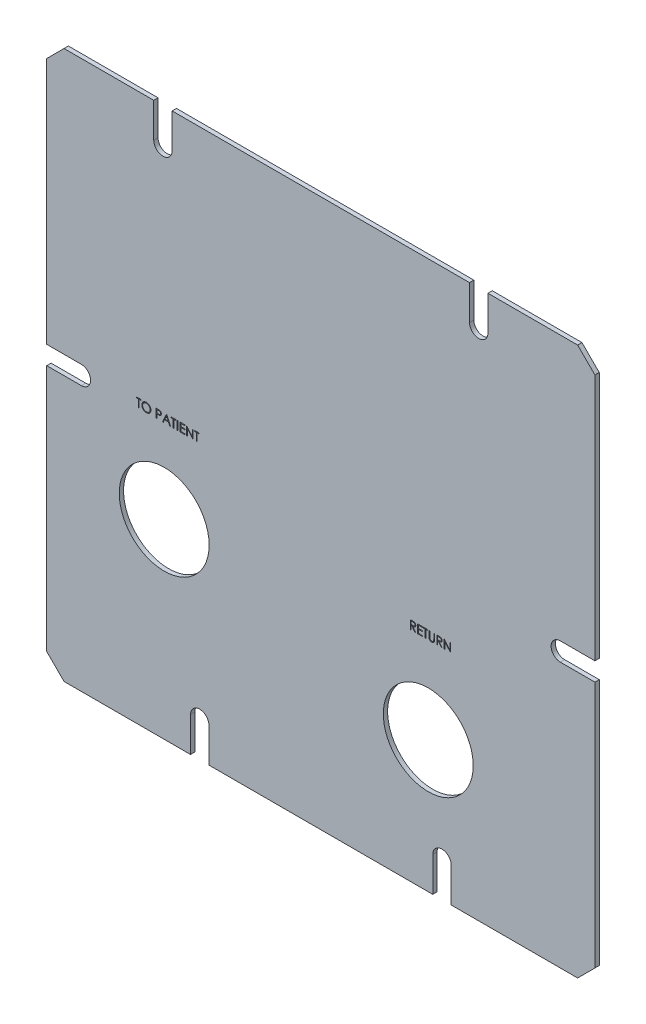
from build123d import *

# Parameters (mm, degrees)
SKETCH1_W               = 201.168
SKETCH1_H               = 201.168
BOSS_EXTRUDE1_DEPTH     = 1.5875
CUT_EXTRUDE1_REACH      = 144.256
SKETCH2_R               = 16.5
F_1_4_CLEARANCE_HOLE1_D = 6.7564
CHAMFER1_SIZE           = 6.35
SKETCH5_W               = 0.284935898
SKETCH5_H               = 3.175
CUT_EXTRUDE2_DEPTH      = 0.508
CUT_EXTRUDE3_REACH      = 144.256
SKETCH6_W               = 6.7564
SKETCH6_H               = 14.478
SKETCH6_W_2             = 14.478
SKETCH6_H_2             = 6.7564


with BuildPart() as part:
    # Sketch1 → Boss-Extrude1 (new body)
    with BuildSketch(Plane.XY):
        Rectangle(SKETCH1_W, SKETCH1_H)
    extrude(amount=BOSS_EXTRUDE1_DEPTH)

    # Sketch2 → Cut-Extrude1 (cut, up to next)
    with BuildSketch(Plane.XY.offset(1.5875), mode=Mode.PRIVATE) as cut_extrude1_sk1:
        with Locations((-57.484, -30.636)):
            Circle(SKETCH2_R)
    cut_extrude1_tool1 = extrude(cut_extrude1_sk1.sketch, amount=-CUT_EXTRUDE1_REACH, mode=Mode.PRIVATE) & part.part
    # Sketch2 → Cut-Extrude1 (cut, up to next)
    with BuildSketch(Plane.XY.offset(1.5875), mode=Mode.PRIVATE) as cut_extrude1_sk2:
        with Locations((39.4206, -52.284)):
            Circle(SKETCH2_R)
    cut_extrude1_tool2 = extrude(cut_extrude1_sk2.sketch, amount=-CUT_EXTRUDE1_REACH, mode=Mode.PRIVATE) & part.part
    add(cut_extrude1_tool1.solids().sort_by_distance((-57.484, -30.636, 1.5875))[0], mode=Mode.SUBTRACT)
    add(cut_extrude1_tool2.solids().sort_by_distance((39.4206, -52.284, 1.5875))[0], mode=Mode.SUBTRACT)

    # 1/4 Clearance Hole1 (through all)
    with Locations(Plane.XY.offset(1.5875)):
        with Locations((-57.94375, 87.884), (57.94375, 87.884), (87.884, 0), (-87.884, 0), (-44.45, -87.884), (44.45, -87.884)):
            Hole(F_1_4_CLEARANCE_HOLE1_D / 2)

    # Chamfer1
    chamfer1_edges = [part.edges().sort_by_distance(p)[0] for p in [
        (100.584, -100.584, 0.79375),
        (-100.584, -100.584, 0.79375),
        (-100.584, 100.584, 0.79375),
        (100.584, 100.584, 0.79375),
    ]]
    chamfer(chamfer1_edges, length=CHAMFER1_SIZE)

    # Sketch5 → Cut-Extrude2 (cut)
    # profile 1 of 15: a face of its own
    with BuildSketch(Plane.XY.offset(1.5875)):
        Polygon((-67.686953674, 2.849358974), (-67.686953674, 3.175), (-66.018043418, 3.175), (-66.018043418, 2.849358974), (-66.710030597, 2.849358974), (-66.710030597, 0), (-66.994966495, 0), (-66.994966495, 2.849358974), align=None)
    # profile 2 of 15: a face of its own
    with BuildSketch(Plane.XY.offset(1.5875)):
        with BuildLine():
            add(Edge.make_bspline(
                [(-64.0438447, 3.256410256), (-63.985054489, 3.2549212), (-63.869585666, 3.251996571), (-63.699882009, 3.229609098), (-63.537870744, 3.19087828), (-63.382232118, 3.139295432), (-63.234827775, 3.070484668), (-63.094548208, 2.98731314), (-62.961727187, 2.888909496), (-62.838154933, 2.776034411), (-62.725073271, 2.653222278), (-62.625445503, 2.522160174), (-62.541949994, 2.383640546), (-62.473382887, 2.23807965), (-62.419590577, 2.085806679), (-62.382471158, 1.926009834), (-62.358760122, 1.759724479), (-62.355988095, 1.646307252), (-62.354581879, 1.588772035)],
                knots=[0, 0, 0, 0, 1.065120563, 2.091984664, 3.0946048, 4.079830382, 5.057816894, 6.036188127, 7.030412546, 8.04752943, 9.064399622, 10.05169764, 11.02544977, 11.989514704, 12.962713494, 13.945757189, 14.957906945, 16, 16, 16, 16], degree=3))
            add(Edge.make_bspline(
                [(-62.354581879, 1.588772035), (-62.355987889, 1.531660637), (-62.358759298, 1.419087456), (-62.382498118, 1.253857332), (-62.419728168, 1.095025057), (-62.472883352, 0.942855786), (-62.541123608, 0.797188996), (-62.625175084, 0.658407974), (-62.724181754, 0.526467222), (-62.836855112, 0.402812161), (-62.9596832, 0.289421599), (-63.091427799, 0.190616618), (-63.229126025, 0.105595448), (-63.374549832, 0.037755973), (-63.52577058, -0.016465698), (-63.684141687, -0.053434155), (-63.848921061, -0.077280259), (-63.961289757, -0.080018484), (-64.018403995, -0.081410256)],
                knots=[0, 0, 0, 0, 1.043624062, 2.057103931, 3.04512605, 4.022047818, 4.998200453, 5.980619268, 6.982898556, 8.009068085, 9.034988726, 10.034168286, 11.015286542, 11.987931943, 12.962482838, 13.94673481, 14.956375938, 16, 16, 16, 16], degree=3))
            add(Edge.make_bspline(
                [(-64.018403995, -0.081410256), (-64.075938913, -0.080004741), (-64.189355551, -0.077234097), (-64.355849862, -0.053483822), (-64.515758958, -0.016344211), (-64.668625548, 0.036732206), (-64.814534877, 0.105327837), (-64.953772309, 0.188970381), (-65.085778964, 0.288218287), (-65.209460406, 0.400855109), (-65.32262575, 0.523475017), (-65.421286041, 0.654860377), (-65.504947393, 0.792433541), (-65.573312702, 0.936576295), (-65.62743689, 1.086591818), (-65.664361975, 1.243480794), (-65.688252446, 1.406348774), (-65.691005485, 1.517240546), (-65.692402392, 1.573507612)],
                knots=[0, 0, 0, 0, 1.053102029, 2.075944431, 3.073151272, 4.055350789, 5.033113405, 6.020478099, 7.024410459, 8.052272461, 9.079885166, 10.07527673, 11.055994387, 12.023226415, 12.992069828, 13.970394897, 14.97016774, 16, 16, 16, 16], degree=3))
            add(Edge.make_bspline(
                [(-65.692402392, 1.573507612), (-65.691917401, 1.611274391), (-65.690953538, 1.686331503), (-65.679349646, 1.797789061), (-65.662511531, 1.907454158), (-65.638379796, 2.015014947), (-65.606818784, 2.120208126), (-65.56957873, 2.223759175), (-65.524094728, 2.324618696), (-65.472677283, 2.423264487), (-65.415289786, 2.518158801), (-65.351902499, 2.607856709), (-65.284741843, 2.693110899), (-65.21111505, 2.771712109), (-65.133448703, 2.845946926), (-65.050482889, 2.914674534), (-64.962723853, 2.978514668), (-64.86979398, 3.036045977), (-64.773983116, 3.088078906), (-64.675216325, 3.132730157), (-64.574835006, 3.17105337), (-64.472369004, 3.20211469), (-64.368090418, 3.226636608), (-64.261771657, 3.243334708), (-64.15349742, 3.254968196), (-64.080552866, 3.255927501), (-64.0438447, 3.256410256)],
                knots=[0, 0, 0, 0, 1.037015668, 2.060948919, 3.074880161, 4.083647147, 5.086022904, 6.090072063, 7.104153813, 8.122640571, 9.144368836, 10.147691507, 11.138137339, 12.123020368, 13.103399296, 14.087645067, 15.080126199, 16.082011238, 17.087798457, 18.072939717, 19.057185487, 20.037253025, 21.01195951, 21.997135196, 22.992090687, 24, 24, 24, 24], degree=3))
        make_face()
        with BuildLine():
            add(Edge.make_bspline(
                [(-64.029852312, 2.930769231), (-64.059982729, 2.930401937), (-64.119955516, 2.929670862), (-64.209113631, 2.920040892), (-64.297099171, 2.906315921), (-64.383930306, 2.886738399), (-64.469243726, 2.860064722), (-64.553834653, 2.829366184), (-64.636931709, 2.791972766), (-64.718260566, 2.74972467), (-64.797104956, 2.702962435), (-64.871502192, 2.651280903), (-64.941644876, 2.595892072), (-65.007361268, 2.536666676), (-65.068458403, 2.473303109), (-65.126138811, 2.406761971), (-65.178090503, 2.335141327), (-65.225702419, 2.260383315), (-65.26830896, 2.182585309), (-65.306196103, 2.102566362), (-65.337187739, 2.019673747), (-65.362462895, 1.934806761), (-65.383417723, 1.848099815), (-65.396692783, 1.758895152), (-65.406428566, 1.667641015), (-65.407117855, 1.605971762), (-65.407466495, 1.574779647)],
                knots=[0, 0, 0, 0, 1.008559885, 2.007477868, 2.99961109, 3.989939068, 4.984837346, 5.991145699, 7.001802488, 8.033829008, 9.059044045, 10.069351652, 11.065060232, 12.050310815, 13.029377138, 14.011219647, 14.996725999, 15.989392538, 16.977580475, 17.965360261, 18.951710183, 19.937753436, 20.929683414, 21.935841486, 22.955955122, 24, 24, 24, 24], degree=3))
            add(Edge.make_bspline(
                [(-65.407466495, 1.574779647), (-65.406310013, 1.52891249), (-65.404034855, 1.438677602), (-65.384116202, 1.306445071), (-65.35343484, 1.179364983), (-65.308207086, 1.05813268), (-65.251646171, 0.94170608), (-65.181771778, 0.831118014), (-65.09898675, 0.726338592), (-65.004949122, 0.628099312), (-64.902149238, 0.538432047), (-64.792990262, 0.459725241), (-64.678641632, 0.393131657), (-64.558805156, 0.338879913), (-64.434120602, 0.29589065), (-64.303784538, 0.266427892), (-64.168665193, 0.247037301), (-64.076562384, 0.245175158), (-64.029852312, 0.244230769)],
                knots=[0, 0, 0, 0, 1.032063989, 2.030389145, 3.003944642, 3.970395727, 4.937377036, 5.913328081, 6.909231446, 7.93887556, 8.970685674, 9.976071282, 10.964166581, 11.944589148, 12.933237628, 13.927779006, 14.949070134, 16, 16, 16, 16], degree=3))
            add(Edge.make_bspline(
                [(-64.029852312, 0.244230769), (-63.99845655, 0.24466212), (-63.936189324, 0.245517617), (-63.8435741, 0.254134274), (-63.752627394, 0.267951755), (-63.663476768, 0.287845993), (-63.576223404, 0.31274453), (-63.490503118, 0.342324398), (-63.407228955, 0.379228061), (-63.325350388, 0.420002274), (-63.246976654, 0.466484417), (-63.172159564, 0.516411882), (-63.102784925, 0.57171913), (-63.037117696, 0.630064575), (-62.975769721, 0.692624637), (-62.919155857, 0.759317981), (-62.867466737, 0.830565577), (-62.8198729, 0.905210195), (-62.777415655, 0.983221081), (-62.740423186, 1.063530146), (-62.709039567, 1.145939638), (-62.683704423, 1.230568421), (-62.663851183, 1.317255762), (-62.650171541, 1.406117733), (-62.640602601, 1.496976565), (-62.639881352, 1.558429921), (-62.639517777, 1.589408053)],
                knots=[0, 0, 0, 0, 1.047197238, 2.076906641, 3.100256066, 4.114471768, 5.12198147, 6.126382909, 7.136867548, 8.15857795, 9.17633901, 10.174870724, 11.156907918, 12.133735059, 13.104061851, 14.077631395, 15.04955518, 16.038496417, 17.029181396, 18.010275684, 18.986308667, 19.968651475, 20.955262928, 21.950658345, 22.966943676, 24, 24, 24, 24], degree=3))
            add(Edge.make_bspline(
                [(-62.639517777, 1.589408053), (-62.639881643, 1.62017426), (-62.64060344, 1.6812047), (-62.650166971, 1.771429871), (-62.663865636, 1.859652427), (-62.683607521, 1.94552602), (-62.709053017, 2.029072539), (-62.740428667, 2.110213517), (-62.77742676, 2.189251237), (-62.819888507, 2.265990349), (-62.867618575, 2.339627433), (-62.919774067, 2.410023907), (-62.97725549, 2.475857751), (-63.038420527, 2.538754224), (-63.104796973, 2.597371881), (-63.176084154, 2.651730167), (-63.251416633, 2.703140923), (-63.331179197, 2.749519112), (-63.413496926, 2.792349166), (-63.497964588, 2.829044004), (-63.583625271, 2.860224427), (-63.670261145, 2.886819102), (-63.758601418, 2.906239244), (-63.848049177, 2.92005326), (-63.938480668, 2.92966751), (-63.999298446, 2.930400825), (-64.029852312, 2.930769231)],
                knots=[0, 0, 0, 0, 1.02996197, 2.043119294, 3.035359645, 4.018872909, 4.991431989, 5.957985074, 6.929999688, 7.912076566, 8.892894881, 9.867085534, 10.843653904, 11.817741046, 12.803660682, 13.806313499, 14.818574707, 15.856120519, 16.894564902, 17.924820532, 18.937903209, 19.946497019, 20.957711757, 21.963978472, 22.977135795, 24, 24, 24, 24], degree=3))
        make_face(mode=Mode.SUBTRACT)
    # profile 3 of 15: a face of its own
    with BuildSketch(Plane.XY.offset(1.5875)):
        with BuildLine():
            Line((-60.482145982, 3.175), (-59.859484724, 3.175))
            add(Edge.make_bspline(
                [(-59.859484724, 3.175), (-59.816657687, 3.174952923), (-59.734599184, 3.17486272), (-59.616929098, 3.172127915), (-59.510058841, 3.16847513), (-59.414218853, 3.163411556), (-59.32911425, 3.157427506), (-59.255130128, 3.149034585), (-59.191684959, 3.140271317), (-59.153669823, 3.131361898), (-59.13633268, 3.127298678)],
                knots=[0, 0, 0, 0, 1.415646017, 2.712440637, 3.8905458, 4.950247383, 5.884950622, 6.709939814, 7.411656543, 8, 8, 8, 8], degree=3))
            add(Edge.make_bspline(
                [(-59.13633268, 3.127298678), (-59.114385689, 3.121291623), (-59.07100886, 3.109419063), (-59.008505771, 3.085639471), (-58.949039068, 3.057443507), (-58.892404726, 3.025308933), (-58.839298693, 2.987857028), (-58.788928642, 2.946605961), (-58.741739088, 2.900603324), (-58.697995397, 2.850365081), (-58.657822759, 2.796734605), (-58.62323369, 2.738911296), (-58.594271134, 2.677868471), (-58.569430595, 2.613648589), (-58.551552211, 2.545712367), (-58.538083952, 2.474531849), (-58.529535376, 2.400114666), (-58.528716623, 2.349260357), (-58.528299828, 2.323372396)],
                knots=[0, 0, 0, 0, 0.999701418, 1.975846123, 2.934577507, 3.890451536, 4.834027766, 5.787354733, 6.749476667, 7.726910423, 8.712836071, 9.690891519, 10.682875813, 11.679750201, 12.712814741, 13.765529915, 14.8625177, 16, 16, 16, 16], degree=3))
            add(Edge.make_bspline(
                [(-58.528299828, 2.323372396), (-58.52868212, 2.297266841), (-58.529430101, 2.24618956), (-58.538407446, 2.171465674), (-58.550499834, 2.100056849), (-58.569093589, 2.032121418), (-58.593446449, 1.968062827), (-58.62201424, 1.906902138), (-58.656470728, 1.849679864), (-58.696062824, 1.796188264), (-58.740106056, 1.74637713), (-58.788414078, 1.700607423), (-58.840791865, 1.659147059), (-58.897072957, 1.62190309), (-58.957806034, 1.589739179), (-59.022069987, 1.560930767), (-59.090423398, 1.536736305), (-59.137724107, 1.524009035), (-59.161773386, 1.517538061)],
                knots=[0, 0, 0, 0, 1.121902311, 2.195077645, 3.232258892, 4.234102512, 5.217864754, 6.176164875, 7.132989551, 8.084763148, 9.034132444, 9.988522005, 10.94243251, 11.903244335, 12.886203696, 13.894208494, 14.929344452, 16, 16, 16, 16], degree=3))
            add(Edge.make_bspline(
                [(-59.161773386, 1.517538061), (-59.18166461, 1.513308071), (-59.225257385, 1.504037802), (-59.29705114, 1.493688702), (-59.380640169, 1.484855307), (-59.47591038, 1.478232132), (-59.582776258, 1.472562155), (-59.701295613, 1.468055384), (-59.831701097, 1.465579017), (-59.92266144, 1.465451298), (-59.970151791, 1.465384615)],
                knots=[0, 0, 0, 0, 0.601384939, 1.31797006, 2.144135048, 3.087295005, 4.142315834, 5.309527816, 6.595305764, 8, 8, 8, 8], degree=3))
            Line((-59.970151791, 1.465384615), (-60.197210084, 1.465384615))
            Line((-60.197210084, 1.465384615), (-60.197210084, 0))
            Line((-60.197210084, 0), (-60.482145982, 0))
            Line((-60.482145982, 0), (-60.482145982, 3.175))
        make_face()
        with BuildLine():
            Line((-60.197210084, 2.849358974), (-60.197210084, 1.791025641))
            Line((-60.197210084, 1.791025641), (-59.641330677, 1.784029447))
            add(Edge.make_bspline(
                [(-59.641330677, 1.784029447), (-59.61418903, 1.784015419), (-59.56179264, 1.783988339), (-59.486104066, 1.787603506), (-59.415882784, 1.791776847), (-59.351344491, 1.797887291), (-59.292460093, 1.806524432), (-59.239131406, 1.815243652), (-59.191771943, 1.827857802), (-59.136346238, 1.8448423), (-59.074584916, 1.873809745), (-59.007395068, 1.915855716), (-58.950453179, 1.969450359), (-58.901178724, 2.029709891), (-58.862075535, 2.096746959), (-58.833449742, 2.16847378), (-58.816630263, 2.244154758), (-58.814374931, 2.295941855), (-58.813235725, 2.322100361)],
                knots=[0, 0, 0, 0, 1.160613943, 2.240541288, 3.23993089, 4.169200891, 5.011653406, 5.7853311, 6.478053781, 7.106038997, 8.262395093, 9.384106736, 10.481365981, 11.59014053, 12.70357646, 13.786202915, 14.881775077, 16, 16, 16, 16], degree=3))
            add(Edge.make_bspline(
                [(-58.813235725, 2.322100361), (-58.814381126, 2.347626012), (-58.816658041, 2.398367848), (-58.833581574, 2.472734295), (-58.86201988, 2.543705256), (-58.901441219, 2.609902269), (-58.949284959, 2.669944969), (-59.00489222, 2.722103078), (-59.068132107, 2.764032765), (-59.126958717, 2.791095813), (-59.179211221, 2.80761967), (-59.224597356, 2.819181061), (-59.275842468, 2.82841179), (-59.332963239, 2.835886196), (-59.395516939, 2.842284693), (-59.464040982, 2.846626258), (-59.538275787, 2.849167579), (-59.58981109, 2.849293631), (-59.61652599, 2.849358974)],
                knots=[0, 0, 0, 0, 1.120700087, 2.227813068, 3.331159281, 4.466773991, 5.599788987, 6.693661531, 7.80175334, 8.91857717, 9.525282508, 10.207424825, 10.974604443, 11.810962634, 12.737642355, 13.736264703, 14.826523623, 16, 16, 16, 16], degree=3))
            Line((-59.61652599, 2.849358974), (-60.197210084, 2.849358974))
        make_face(mode=Mode.SUBTRACT)
    # profile 4 of 15: a face of its own
    with BuildSketch(Plane.XY.offset(1.5875)):
        Polygon((-56.574453674, 3.175), (-55.109069059, 0), (-55.418809644, 0), (-55.888190653, 1.017628205), (-57.327498546, 1.017628205), (-57.810235926, 0), (-58.121248546, 0), (-56.615158802, 3.175), align=None)
        Polygon((-56.597986326, 2.556154848), (-57.172946262, 1.343269231), (-56.038290813, 1.343269231), align=None, mode=Mode.SUBTRACT)
    # profile 5 of 15: a face of its own
    with BuildSketch(Plane.XY.offset(1.5875)):
        Polygon((-54.905543418, 2.849358974), (-54.905543418, 3.175), (-53.236633161, 3.175), (-53.236633161, 2.849358974), (-53.928620341, 2.849358974), (-53.928620341, 0), (-54.213556238, 0), (-54.213556238, 2.849358974), align=None)
    # profile 6 of 15: a face of its own
    with BuildSketch(Plane.XY.offset(1.5875)):
        with Locations((-52.605703674, 1.5875)):
            Rectangle(SKETCH5_W, SKETCH5_H)
    # profile 7 of 15: a face of its own
    with BuildSketch(Plane.XY.offset(1.5875)):
        Polygon((-51.649133161, 3.175), (-49.85810752, 3.175), (-49.85810752, 2.849358974), (-51.364197264, 2.849358974), (-51.364197264, 1.872435897), (-49.85810752, 1.872435897), (-49.85810752, 1.546794872), (-51.364197264, 1.546794872), (-51.364197264, 0.325641026), (-49.85810752, 0.325641026), (-49.85810752, 0), (-51.649133161, 0), align=None)
    # profile 8 of 15: a face of its own
    with BuildSketch(Plane.XY.offset(1.5875)):
        Polygon((-49.288235725, 0), (-49.288235725, 3.175), (-49.228450068, 3.175), (-47.13086393, 0.676086739), (-47.13086393, 3.175), (-46.845928033, 3.175), (-46.845928033, 0), (-46.910801831, 0), (-49.003299828, 2.493189103), (-49.003299828, 0), align=None)
    # profile 9 of 15: a face of its own
    with BuildSketch(Plane.XY.offset(1.5875)):
        Polygon((-46.398171623, 2.849358974), (-46.398171623, 3.175), (-44.729261366, 3.175), (-44.729261366, 2.849358974), (-45.421248546, 2.849358974), (-45.421248546, 0), (-45.706184443, 0), (-45.706184443, 2.849358974), align=None)
    # profile 10 of 15: a face of its own
    with BuildSketch(Plane.XY.offset(1.5875)):
        Polygon((45.225025641, -20.534), (45.225025641, -17.359), (45.284811298, -17.359), (47.382397436, -19.857913261), (47.382397436, -17.359), (47.667333333, -17.359), (47.667333333, -20.534), (47.602459535, -20.534), (45.509961538, -18.040810897), (45.509961538, -20.534), align=None)
    # profile 11 of 15: a face of its own
    with BuildSketch(Plane.XY.offset(1.5875)):
        with BuildLine():
            Line((42.538487179, -17.359), (43.17386879, -17.359))
            add(Edge.make_bspline(
                [(43.17386879, -17.359), (43.216269671, -17.359141139), (43.297684059, -17.359412141), (43.414318383, -17.360923226), (43.520297249, -17.365254248), (43.615565247, -17.36898132), (43.700120626, -17.375777582), (43.774222669, -17.382273311), (43.83753008, -17.390776561), (43.875853102, -17.398673623), (43.893204728, -17.402249199)],
                knots=[0, 0, 0, 0, 1.410062039, 2.707475311, 3.878576406, 4.937260626, 5.877586885, 6.699081471, 7.410979367, 8, 8, 8, 8], degree=3))
            add(Edge.make_bspline(
                [(43.893204728, -17.402249199), (43.916433594, -17.407988479), (43.962395791, -17.419344604), (44.028571923, -17.443347242), (44.091631345, -17.471123616), (44.151312114, -17.503747848), (44.207315296, -17.541462112), (44.260218335, -17.583615338), (44.310261291, -17.629976874), (44.355420342, -17.681715623), (44.398000767, -17.735995886), (44.433913307, -17.794691437), (44.464870899, -17.856070108), (44.48951844, -17.920756123), (44.509364887, -17.988122159), (44.52335869, -18.058778424), (44.531750839, -18.132403023), (44.532605236, -18.182620555), (44.533038462, -18.208083534)],
                knots=[0, 0, 0, 0, 1.027469482, 2.033020251, 3.019912614, 3.986113645, 4.951240523, 5.91722682, 6.890402269, 7.87763091, 8.8651537, 9.85103654, 10.82876324, 11.815024772, 12.821070561, 13.842952187, 14.906261191, 16, 16, 16, 16], degree=3))
            add(Edge.make_bspline(
                [(44.533038462, -18.208083534), (44.53170587, -18.250388236), (44.52910564, -18.332935667), (44.504862153, -18.452733752), (44.465150596, -18.564484059), (44.410428755, -18.66804588), (44.340742516, -18.761400537), (44.256990742, -18.843397593), (44.159126708, -18.912013799), (44.068022972, -18.959595987), (43.987546519, -18.990069554), (43.921294871, -19.011511108), (43.849025542, -19.028077319), (43.771430959, -19.042918296), (43.688188215, -19.054123047), (43.599496822, -19.062329601), (43.505293527, -19.067458631), (43.4405788, -19.068222449), (43.40728726, -19.068615385)],
                knots=[0, 0, 0, 0, 1.260483769, 2.459530307, 3.627416485, 4.787058657, 5.939039949, 7.08810263, 8.267026773, 9.491475466, 10.141966685, 10.831826277, 11.566392101, 12.351337768, 13.187381173, 14.07005841, 15.007169909, 16, 16, 16, 16], degree=3))
            Line((43.40728726, -19.068615385), (44.57374359, -20.534))
            Line((44.57374359, -20.534), (44.221389824, -20.534))
            Line((44.221389824, -20.534), (43.054933494, -19.068615385))
            Line((43.054933494, -19.068615385), (42.823423077, -19.068615385))
            Line((42.823423077, -19.068615385), (42.823423077, -20.534))
            Line((42.823423077, -20.534), (42.538487179, -20.534))
            Line((42.538487179, -20.534), (42.538487179, -17.359))
        make_face()
        with BuildLine():
            Line((42.823423077, -17.684641026), (42.823423077, -18.742974359))
            Line((42.823423077, -18.742974359), (43.404743189, -18.747426482))
            add(Edge.make_bspline(
                [(43.404743189, -18.747426482), (43.431884939, -18.74743849), (43.48449338, -18.747461764), (43.560603269, -18.743838838), (43.63146937, -18.7397174), (43.696820624, -18.73341335), (43.756686224, -18.725288914), (43.811036249, -18.715126207), (43.859959417, -18.703286121), (43.917017377, -18.684960361), (43.980731945, -18.65592633), (44.049975484, -18.613684771), (44.10894189, -18.560554212), (44.158760237, -18.49979972), (44.198791935, -18.433001123), (44.227015013, -18.360959131), (44.244924229, -18.285492467), (44.247036552, -18.233623755), (44.248102564, -18.207447516)],
                knots=[0, 0, 0, 0, 1.146690395, 2.22261258, 3.21895312, 4.145990853, 4.996080663, 5.770904154, 6.481378293, 7.121626537, 8.300444488, 9.431385265, 10.535395872, 11.636531494, 12.74115979, 13.810798291, 14.895190096, 16, 16, 16, 16], degree=3))
            add(Edge.make_bspline(
                [(44.248102564, -18.207447516), (44.247012069, -18.181914553), (44.244851104, -18.131317536), (44.227208293, -18.05724396), (44.197372925, -17.987333227), (44.157166324, -17.92186973), (44.108181376, -17.86244667), (44.050743075, -17.811603895), (43.986421933, -17.769649024), (43.926304489, -17.742838978), (43.872570596, -17.726401683), (43.825916548, -17.714834556), (43.773201136, -17.705541359), (43.714168398, -17.698095475), (43.649070347, -17.691695633), (43.577577828, -17.687385091), (43.500165178, -17.684832514), (43.446510461, -17.684706341), (43.418735577, -17.684641026)],
                knots=[0, 0, 0, 0, 1.101028733, 2.181837193, 3.264309656, 4.369019818, 5.486613113, 6.575447106, 7.666700264, 8.788928104, 9.402425223, 10.0903467, 10.862060571, 11.710948788, 12.657782767, 13.684531032, 14.801375019, 16, 16, 16, 16], degree=3))
            Line((43.418735577, -17.684641026), (42.823423077, -17.684641026))
        make_face(mode=Mode.SUBTRACT)
    # profile 12 of 15: a face of its own
    with BuildSketch(Plane.XY.offset(1.5875)):
        with BuildLine():
            Line((39.689128205, -17.359), (39.974064103, -17.359))
            Line((39.974064103, -17.359), (39.974064103, -19.261328726))
            add(Edge.make_bspline(
                [(39.974064103, -19.261328726), (39.974021699, -19.288253393), (39.973941231, -19.33934759), (39.974478726, -19.412071691), (39.97598401, -19.476725993), (39.976933026, -19.533559716), (39.97904425, -19.582312065), (39.98076605, -19.623247168), (39.982979984, -19.656171195), (39.98564074, -19.675385321), (39.986784455, -19.683644431)],
                knots=[0, 0, 0, 0, 1.528628734, 2.90083645, 4.128790002, 5.200304208, 6.127813768, 6.898992206, 7.526736466, 8, 8, 8, 8], degree=3))
            add(Edge.make_bspline(
                [(39.986784455, -19.683644431), (39.99148115, -19.713441138), (40.000609898, -19.771355614), (40.023874826, -19.853822412), (40.056366416, -19.928145949), (40.094868319, -19.996645478), (40.145607188, -20.057414397), (40.206388966, -20.113395682), (40.280028799, -20.162355819), (40.361908063, -20.207124056), (40.450159671, -20.243105952), (40.540339892, -20.270314218), (40.631093166, -20.286895791), (40.691850115, -20.288815795), (40.722020833, -20.289769231)],
                knots=[0, 0, 0, 0, 1.035780045, 2.013197591, 2.933192213, 3.817615948, 4.702609284, 5.640816605, 6.646850145, 7.73207398, 8.84249596, 9.914020372, 10.964143139, 12, 12, 12, 12], degree=3))
            add(Edge.make_bspline(
                [(40.722020833, -20.289769231), (40.747923155, -20.288795095), (40.799578193, -20.28685245), (40.876328313, -20.274822438), (40.951076983, -20.25314121), (41.024193314, -20.225165144), (41.092728849, -20.188201258), (41.156721829, -20.145501282), (41.213839112, -20.09541713), (41.265961725, -20.039990389), (41.311350559, -19.977452142), (41.35069438, -19.909164117), (41.382921474, -19.834098638), (41.398835957, -19.781344269), (41.407011819, -19.754242388)],
                knots=[0, 0, 0, 0, 0.994687771, 1.983630487, 2.973142513, 3.978332533, 4.983357753, 5.956394766, 6.925816176, 7.893390482, 8.871859704, 9.88551698, 10.913711441, 12, 12, 12, 12], degree=3))
            add(Edge.make_bspline(
                [(41.407011819, -19.754242388), (41.409733361, -19.743040467), (41.415798054, -19.718078072), (41.421465016, -19.675876616), (41.427367364, -19.626084122), (41.431462724, -19.568342834), (41.43545526, -19.502846238), (41.437843833, -19.429253133), (41.438947856, -19.347830747), (41.439276859, -19.291009893), (41.439448718, -19.261328726)],
                knots=[0, 0, 0, 0, 0.558680831, 1.244966039, 2.062412453, 2.990489873, 4.051219941, 5.244515665, 6.560634259, 8, 8, 8, 8], degree=3))
            Line((41.439448718, -19.261328726), (41.439448718, -17.359))
            Line((41.439448718, -17.359), (41.724384615, -17.359))
            Line((41.724384615, -17.359), (41.724384615, -19.276593149))
            add(Edge.make_bspline(
                [(41.724384615, -19.276593149), (41.724154092, -19.311153821), (41.723704211, -19.378601075), (41.719802974, -19.477435522), (41.713582696, -19.571191441), (41.704794216, -19.659881434), (41.69314922, -19.743188135), (41.680199556, -19.821841747), (41.663708122, -19.895277676), (41.644446394, -19.964068512), (41.622426818, -20.029551085), (41.593905205, -20.091698185), (41.561770123, -20.152399105), (41.523656831, -20.210735746), (41.480829362, -20.266966405), (41.432341052, -20.320750066), (41.379795563, -20.372946201), (41.322319391, -20.422215911), (41.260859986, -20.467399496), (41.195600167, -20.507130332), (41.12704124, -20.540716042), (41.055361419, -20.568362059), (40.980530113, -20.589148874), (40.902545437, -20.604638479), (40.821229883, -20.613439849), (40.765926231, -20.614747886), (40.737921274, -20.615410256)],
                knots=[0, 0, 0, 0, 1.316592851, 2.569410997, 3.76748051, 4.895814652, 5.963796859, 6.97159953, 7.931736103, 8.829262218, 9.692595152, 10.560224239, 11.431080259, 12.30701507, 13.211635791, 14.121146779, 15.063487852, 16.031507147, 17.00238618, 17.966455255, 18.938106653, 19.907068911, 20.888905087, 21.893141452, 22.933117798, 24, 24, 24, 24], degree=3))
            add(Edge.make_bspline(
                [(40.737921274, -20.615410256), (40.707378588, -20.614698362), (40.647453948, -20.613301628), (40.559154415, -20.605298134), (40.474505108, -20.590222876), (40.392611991, -20.571027784), (40.314589998, -20.544553965), (40.239393802, -20.513622095), (40.168311284, -20.475633437), (40.100189274, -20.433366574), (40.036848245, -20.385809938), (39.978702744, -20.333975637), (39.925656776, -20.278694009), (39.878604458, -20.219366534), (39.836766227, -20.156454629), (39.800725248, -20.089780318), (39.769779662, -20.019369417), (39.753807991, -19.970426157), (39.745733774, -19.945683694)],
                knots=[0, 0, 0, 0, 1.13879206, 2.234305948, 3.301075583, 4.341971843, 5.366689343, 6.369221514, 7.369726634, 8.367512178, 9.355451585, 10.318319045, 11.268648973, 12.207971039, 13.137398894, 14.081662264, 15.030215811, 16, 16, 16, 16], degree=3))
            add(Edge.make_bspline(
                [(39.745733774, -19.945683694), (39.741037352, -19.928781287), (39.730850708, -19.89211959), (39.719942045, -19.83144399), (39.710771664, -19.761580457), (39.702148765, -19.682524211), (39.697060638, -19.594213975), (39.692599819, -19.49668803), (39.689096779, -19.38982845), (39.689117437, -19.315393282), (39.689128205, -19.276593149)],
                knots=[0, 0, 0, 0, 0.625038921, 1.35572334, 2.194682327, 3.136881307, 4.189498639, 5.346923369, 6.617055217, 8, 8, 8, 8], degree=3))
            Line((39.689128205, -19.276593149), (39.689128205, -17.359))
        make_face()
    # profile 13 of 15: a face of its own
    with BuildSketch(Plane.XY.offset(1.5875)):
        Polygon((37.53175641, -17.684641026), (37.53175641, -17.359), (39.200666667, -17.359), (39.200666667, -17.684641026), (38.508679487, -17.684641026), (38.508679487, -20.534), (38.22374359, -20.534), (38.22374359, -17.684641026), align=None)
    # profile 14 of 15: a face of its own
    with BuildSketch(Plane.XY.offset(1.5875)):
        Polygon((35.537205128, -17.359), (37.328230769, -17.359), (37.328230769, -17.684641026), (35.822141026, -17.684641026), (35.822141026, -18.661564103), (37.328230769, -18.661564103), (37.328230769, -18.987205128), (35.822141026, -18.987205128), (35.822141026, -20.208358974), (37.328230769, -20.208358974), (37.328230769, -20.534), (35.537205128, -20.534), align=None)
    # profile 15 of 15: a face of its own
    with BuildSketch(Plane.XY.offset(1.5875)):
        with BuildLine():
            Line((32.850666667, -17.359), (33.486048277, -17.359))
            add(Edge.make_bspline(
                [(33.486048277, -17.359), (33.528449158, -17.359141139), (33.609863546, -17.359412141), (33.72649787, -17.360923226), (33.832476737, -17.365254248), (33.927744734, -17.36898132), (34.012300114, -17.375777582), (34.086402156, -17.382273311), (34.149709567, -17.390776561), (34.188032589, -17.398673623), (34.205384215, -17.402249199)],
                knots=[0, 0, 0, 0, 1.410062039, 2.707475311, 3.878576406, 4.937260626, 5.877586885, 6.699081471, 7.410979367, 8, 8, 8, 8], degree=3))
            add(Edge.make_bspline(
                [(34.205384215, -17.402249199), (34.228613081, -17.407988479), (34.274575279, -17.419344604), (34.34075141, -17.443347242), (34.403810832, -17.471123616), (34.463491602, -17.503747848), (34.519494784, -17.541462112), (34.572397823, -17.583615338), (34.622440779, -17.629976874), (34.667599829, -17.681715623), (34.710180254, -17.735995886), (34.746092794, -17.794691437), (34.777050386, -17.856070108), (34.801697927, -17.920756123), (34.821544374, -17.988122159), (34.835538177, -18.058778424), (34.843930326, -18.132403023), (34.844784723, -18.182620555), (34.845217949, -18.208083534)],
                knots=[0, 0, 0, 0, 1.027469482, 2.033020251, 3.019912614, 3.986113645, 4.951240523, 5.91722682, 6.890402269, 7.87763091, 8.8651537, 9.85103654, 10.82876324, 11.815024772, 12.821070561, 13.842952187, 14.906261191, 16, 16, 16, 16], degree=3))
            add(Edge.make_bspline(
                [(34.845217949, -18.208083534), (34.843885358, -18.250388236), (34.841285127, -18.332935667), (34.81704164, -18.452733752), (34.777330083, -18.564484059), (34.722608242, -18.66804588), (34.652922004, -18.761400537), (34.569170229, -18.843397593), (34.471306196, -18.912013799), (34.380202459, -18.959595987), (34.299726006, -18.990069554), (34.233474358, -19.011511108), (34.161205029, -19.028077319), (34.083610447, -19.042918296), (34.000367702, -19.054123047), (33.911676309, -19.062329601), (33.817473014, -19.067458631), (33.752758287, -19.068222449), (33.719466747, -19.068615385)],
                knots=[0, 0, 0, 0, 1.260483769, 2.459530307, 3.627416485, 4.787058657, 5.939039949, 7.08810263, 8.267026773, 9.491475466, 10.141966685, 10.831826277, 11.566392101, 12.351337768, 13.187381173, 14.07005841, 15.007169909, 16, 16, 16, 16], degree=3))
            Line((33.719466747, -19.068615385), (34.885923077, -20.534))
            Line((34.885923077, -20.534), (34.533569311, -20.534))
            Line((34.533569311, -20.534), (33.367112981, -19.068615385))
            Line((33.367112981, -19.068615385), (33.135602564, -19.068615385))
            Line((33.135602564, -19.068615385), (33.135602564, -20.534))
            Line((33.135602564, -20.534), (32.850666667, -20.534))
            Line((32.850666667, -20.534), (32.850666667, -17.359))
        make_face()
        with BuildLine():
            Line((33.135602564, -17.684641026), (33.135602564, -18.742974359))
            Line((33.135602564, -18.742974359), (33.716922676, -18.747426482))
            add(Edge.make_bspline(
                [(33.716922676, -18.747426482), (33.744064426, -18.74743849), (33.796672867, -18.747461764), (33.872782756, -18.743838838), (33.943648857, -18.7397174), (34.009000111, -18.73341335), (34.068865711, -18.725288914), (34.123215736, -18.715126207), (34.172138905, -18.703286121), (34.229196865, -18.684960361), (34.292911432, -18.65592633), (34.362154971, -18.613684771), (34.421121377, -18.560554212), (34.470939724, -18.49979972), (34.510971422, -18.433001123), (34.5391945, -18.360959131), (34.557103716, -18.285492467), (34.559216039, -18.233623755), (34.560282051, -18.207447516)],
                knots=[0, 0, 0, 0, 1.146690395, 2.22261258, 3.21895312, 4.145990853, 4.996080663, 5.770904154, 6.481378293, 7.121626537, 8.300444488, 9.431385265, 10.535395872, 11.636531494, 12.74115979, 13.810798291, 14.895190096, 16, 16, 16, 16], degree=3))
            add(Edge.make_bspline(
                [(34.560282051, -18.207447516), (34.559191556, -18.181914553), (34.557030591, -18.131317536), (34.53938778, -18.05724396), (34.509552413, -17.987333227), (34.469345811, -17.92186973), (34.420360863, -17.86244667), (34.362922562, -17.811603895), (34.298601421, -17.769649024), (34.238483976, -17.742838978), (34.184750084, -17.726401683), (34.138096035, -17.714834556), (34.085380623, -17.705541359), (34.026347885, -17.698095475), (33.961249835, -17.691695633), (33.889757315, -17.687385091), (33.812344665, -17.684832514), (33.758689949, -17.684706341), (33.730915064, -17.684641026)],
                knots=[0, 0, 0, 0, 1.101028733, 2.181837193, 3.264309656, 4.369019818, 5.486613113, 6.575447106, 7.666700264, 8.788928104, 9.402425223, 10.0903467, 10.862060571, 11.710948788, 12.657782767, 13.684531032, 14.801375019, 16, 16, 16, 16], degree=3))
            Line((33.730915064, -17.684641026), (33.135602564, -17.684641026))
        make_face(mode=Mode.SUBTRACT)
    extrude(amount=-CUT_EXTRUDE2_DEPTH, mode=Mode.SUBTRACT)

    # Sketch6 → Cut-Extrude3 (cut, up to next)
    with BuildSketch(Plane.XY.offset(1.5875), mode=Mode.PRIVATE) as cut_extrude3_sk1:
        with Locations((-57.94375, 95.123)):
            Rectangle(SKETCH6_W, SKETCH6_H)
    cut_extrude3_tool1 = extrude(cut_extrude3_sk1.sketch, amount=-CUT_EXTRUDE3_REACH, mode=Mode.PRIVATE) & part.part
    # Sketch6 → Cut-Extrude3 (cut, up to next)
    with BuildSketch(Plane.XY.offset(1.5875), mode=Mode.PRIVATE) as cut_extrude3_sk2:
        with Locations((57.94375, 95.123)):
            Rectangle(SKETCH6_W, SKETCH6_H)
    cut_extrude3_tool2 = extrude(cut_extrude3_sk2.sketch, amount=-CUT_EXTRUDE3_REACH, mode=Mode.PRIVATE) & part.part
    # Sketch6 → Cut-Extrude3 (cut, up to next)
    with BuildSketch(Plane.XY.offset(1.5875), mode=Mode.PRIVATE) as cut_extrude3_sk3:
        with Locations((-44.45, -95.123)):
            Rectangle(SKETCH6_W, SKETCH6_H)
    cut_extrude3_tool3 = extrude(cut_extrude3_sk3.sketch, amount=-CUT_EXTRUDE3_REACH, mode=Mode.PRIVATE) & part.part
    # Sketch6 → Cut-Extrude3 (cut, up to next)
    with BuildSketch(Plane.XY.offset(1.5875), mode=Mode.PRIVATE) as cut_extrude3_sk4:
        with Locations((44.45, -95.123)):
            Rectangle(SKETCH6_W, SKETCH6_H)
    cut_extrude3_tool4 = extrude(cut_extrude3_sk4.sketch, amount=-CUT_EXTRUDE3_REACH, mode=Mode.PRIVATE) & part.part
    # Sketch6 → Cut-Extrude3 (cut, up to next)
    with BuildSketch(Plane.XY.offset(1.5875), mode=Mode.PRIVATE) as cut_extrude3_sk5:
        with Locations((-95.123, 0)):
            Rectangle(SKETCH6_W_2, SKETCH6_H_2)
    cut_extrude3_tool5 = extrude(cut_extrude3_sk5.sketch, amount=-CUT_EXTRUDE3_REACH, mode=Mode.PRIVATE) & part.part
    # Sketch6 → Cut-Extrude3 (cut, up to next)
    with BuildSketch(Plane.XY.offset(1.5875), mode=Mode.PRIVATE) as cut_extrude3_sk6:
        with Locations((95.123, 0)):
            Rectangle(SKETCH6_W_2, SKETCH6_H_2)
    cut_extrude3_tool6 = extrude(cut_extrude3_sk6.sketch, amount=-CUT_EXTRUDE3_REACH, mode=Mode.PRIVATE) & part.part
    add(cut_extrude3_tool1.solids().sort_by_distance((-57.94375, 95.123, 1.5875))[0], mode=Mode.SUBTRACT)
    add(cut_extrude3_tool2.solids().sort_by_distance((57.94375, 95.123, 1.5875))[0], mode=Mode.SUBTRACT)
    add(cut_extrude3_tool3.solids().sort_by_distance((-44.45, -95.123, 1.5875))[0], mode=Mode.SUBTRACT)
    add(cut_extrude3_tool4.solids().sort_by_distance((44.45, -95.123, 1.5875))[0], mode=Mode.SUBTRACT)
    add(cut_extrude3_tool5.solids().sort_by_distance((-95.123, 0, 1.5875))[0], mode=Mode.SUBTRACT)
    add(cut_extrude3_tool6.solids().sort_by_distance((95.123, 0, 1.5875))[0], mode=Mode.SUBTRACT)


solid = part.part
